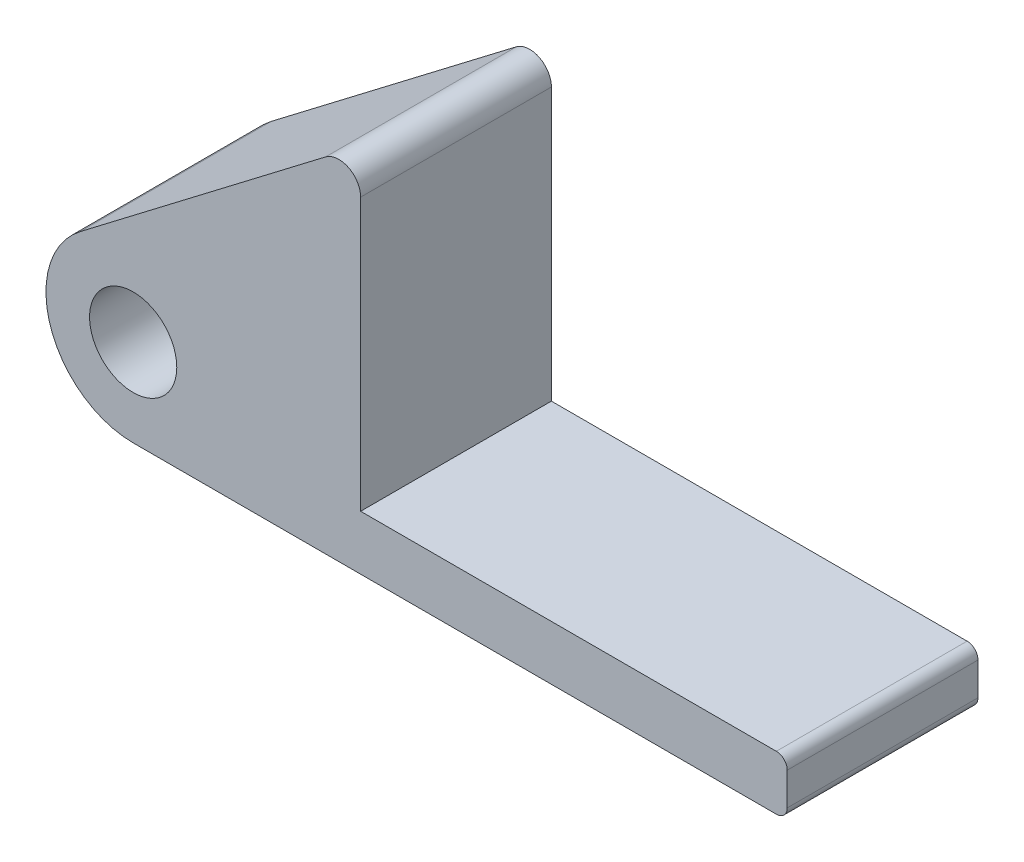
from build123d import *

# Parameters (mm, degrees)
ESQUISSE1_R        = 8
ESQUISSE1_R_2      = 4
BOSS_EXTRU_2_DEPTH = 17.5
CONG_1_R           = 2
CONG_2_R           = 1


with BuildPart() as part:
    # Esquisse1 → Boss.-Extru.2 (new body)
    # profile 1 of 2: a face of its own
    with BuildSketch(Plane.XY):
        with BuildLine():
            Line((20.866963315, 26), (-4.855214383, 6.358214631))
            ThreePointArc((-4.855214383, 6.358214631), (3.546708681, 7.17083381), (8, 0))
            ThreePointArc((8, 0), (5.656854249, -5.656854249), (0, -8))
            Line((0, -8), (60, -8))
            Line((60, -8), (60, -3))
            Line((60, -3), (20.866963315, -3))
            Line((20.866963315, -3), (20.866963315, 26))
        make_face()
    # profile 2 of 2: a face of its own
    with BuildSketch(Plane.XY):
        Circle(ESQUISSE1_R)
        Circle(ESQUISSE1_R_2, mode=Mode.SUBTRACT)
    extrude(amount=-BOSS_EXTRU_2_DEPTH)

    # Congé1
    cong_1_edges = [part.edges().sort_by_distance(p)[0] for p in [
        (20.866963315, 26, -8.75),
    ]]
    fillet(cong_1_edges, radius=CONG_1_R)

    # Congé2
    cong_2_edges = [part.edges().sort_by_distance(p)[0] for p in [
        (60, -3, -8.75),
        (60, -8, -8.75),
    ]]
    fillet(cong_2_edges, radius=CONG_2_R)


solid = part.part
